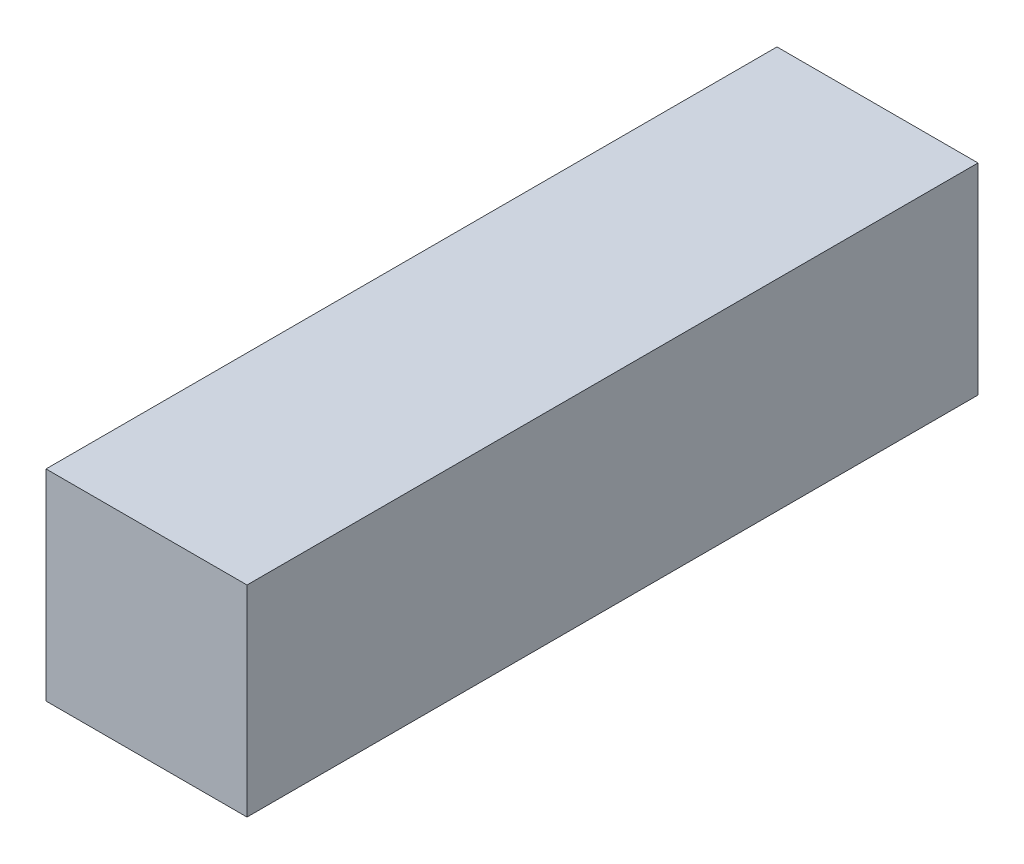
from build123d import *

# Parameters (mm, degrees)
SKETCH1_W           = 22
SKETCH1_H           = 22
BOSS_EXTRUDE1_DEPTH = 80


with BuildPart() as part:
    # Sketch1 → Boss-Extrude1 (new body)
    with BuildSketch(Plane.XY):
        Rectangle(SKETCH1_W, SKETCH1_H)
    extrude(amount=BOSS_EXTRUDE1_DEPTH)


solid = part.part
